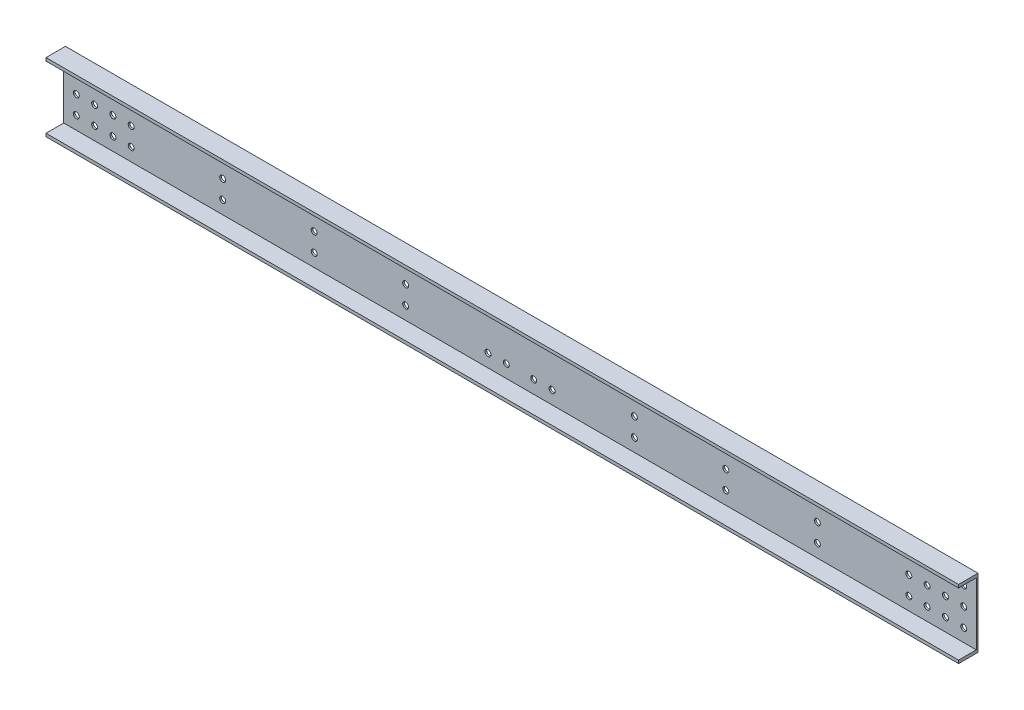
from build123d import *

# Parameters (mm, degrees)
SKETCH_1_W                       = 3990
SKETCH_1_H                       = 300
SKETCH_1_R                       = 13
EXTRUDE_704_DEPTH                = 7.5
SKETCH_2_W                       = 3990
SKETCH_2_H                       = 13.5
EXTRUDE_1_DEPTH                  = 77.5
SKETCH_3_R                       = 13
CUT_EXTRUDE_1_DEPTH              = 2003.436016456
PATTERN_LINEAR_1_COUNT           = 3
PATTERN_LINEAR_1_PITCH           = 400
PATTERN_LINEAR_2_COUNT           = 2
PATTERN_LINEAR_2_PITCH           = 1800
PATTERN_LINEAR_2_COPY_1_SKETCH_R = 13
PATTERN_LINEAR_2_COPY_1_DEPTH    = 2003.436016456
PATTERN_LINEAR_2_COPY_2_SKETCH_R = 13
PATTERN_LINEAR_2_COPY_2_DEPTH    = 2003.436016456


with BuildPart() as part:
    # 草图1 → Extrude 704 (new body)
    with BuildSketch(Plane.XY):
        Rectangle(SKETCH_1_W, SKETCH_1_H)
        with Locations((1940, 0)):
            Circle(SKETCH_1_R, mode=Mode.SUBTRACT)
        with Locations((1860, 0)):
            Circle(SKETCH_1_R, mode=Mode.SUBTRACT)
        with Locations((1780, 0)):
            Circle(SKETCH_1_R, mode=Mode.SUBTRACT)
        with Locations((1700, 0)):
            Circle(SKETCH_1_R, mode=Mode.SUBTRACT)
        with Locations((1700, 80)):
            Circle(SKETCH_1_R, mode=Mode.SUBTRACT)
        with Locations((1780, 80)):
            Circle(SKETCH_1_R, mode=Mode.SUBTRACT)
        with Locations((1860, 80)):
            Circle(SKETCH_1_R, mode=Mode.SUBTRACT)
        with Locations((1940, 80)):
            Circle(SKETCH_1_R, mode=Mode.SUBTRACT)
        with Locations(Location((1940, -80, 0), (0, 0, 180))):
            Circle(SKETCH_1_R, mode=Mode.SUBTRACT)
        with Locations(Location((1860, -80, 0), (0, 0, 180))):
            Circle(SKETCH_1_R, mode=Mode.SUBTRACT)
        with Locations(Location((1780, -80, 0), (0, 0, 180))):
            Circle(SKETCH_1_R, mode=Mode.SUBTRACT)
        with Locations(Location((1700, -80, 0), (0, 0, 180))):
            Circle(SKETCH_1_R, mode=Mode.SUBTRACT)
        with Locations((-1700, -80)):
            Circle(SKETCH_1_R, mode=Mode.SUBTRACT)
        with Locations((-1780, -80)):
            Circle(SKETCH_1_R, mode=Mode.SUBTRACT)
        with Locations((-1860, -80)):
            Circle(SKETCH_1_R, mode=Mode.SUBTRACT)
        with Locations((-1940, -80)):
            Circle(SKETCH_1_R, mode=Mode.SUBTRACT)
        with Locations(Location((-1940, 80, 0), (0, 0, 180))):
            Circle(SKETCH_1_R, mode=Mode.SUBTRACT)
        with Locations(Location((-1860, 80, 0), (0, 0, 180))):
            Circle(SKETCH_1_R, mode=Mode.SUBTRACT)
        with Locations(Location((-1780, 80, 0), (0, 0, 180))):
            Circle(SKETCH_1_R, mode=Mode.SUBTRACT)
        with Locations(Location((-1700, 80, 0), (0, 0, 180))):
            Circle(SKETCH_1_R, mode=Mode.SUBTRACT)
        with Locations(Location((-1700, 0, 0), (0, 0, 180))):
            Circle(SKETCH_1_R, mode=Mode.SUBTRACT)
        with Locations(Location((-1780, 0, 0), (0, 0, 180))):
            Circle(SKETCH_1_R, mode=Mode.SUBTRACT)
        with Locations(Location((-1860, 0, 0), (0, 0, 180))):
            Circle(SKETCH_1_R, mode=Mode.SUBTRACT)
        with Locations(Location((-1940, 0, 0), (0, 0, 180))):
            Circle(SKETCH_1_R, mode=Mode.SUBTRACT)
        with Locations((60, 80)):
            Circle(SKETCH_1_R, mode=Mode.SUBTRACT)
        with Locations((140, 80)):
            Circle(SKETCH_1_R, mode=Mode.SUBTRACT)
        with Locations(Location((140, -80, 0), (0, 0, 180))):
            Circle(SKETCH_1_R, mode=Mode.SUBTRACT)
        with Locations(Location((60, -80, 0), (0, 0, 180))):
            Circle(SKETCH_1_R, mode=Mode.SUBTRACT)
        with Locations((-60, -80)):
            Circle(SKETCH_1_R, mode=Mode.SUBTRACT)
        with Locations((-140, -80)):
            Circle(SKETCH_1_R, mode=Mode.SUBTRACT)
        with Locations(Location((-140, 80, 0), (0, 0, 180))):
            Circle(SKETCH_1_R, mode=Mode.SUBTRACT)
        with Locations(Location((-60, 80, 0), (0, 0, 180))):
            Circle(SKETCH_1_R, mode=Mode.SUBTRACT)
    extrude(amount=EXTRUDE_704_DEPTH)

    # 草图2 → 凸台-拉伸1 (add)
    with BuildSketch(Plane.XY.offset(7.5)):
        with Locations((0, 143.25)):
            Rectangle(SKETCH_2_W, SKETCH_2_H)
        with Locations((0, -143.25)):
            Rectangle(SKETCH_2_W, SKETCH_2_H)
    extrude(amount=EXTRUDE_1_DEPTH)

    # 草图3 → 切除-拉伸1 (cut, through all)
    with BuildSketch(Plane(origin=(0, 0, 0), x_dir=(-1, 0, 0), z_dir=(0, 0, -1))):
        with Locations((-1300, 80)):
            Circle(SKETCH_3_R)
        with Locations((-1300, 0)):
            Circle(SKETCH_3_R)
        with Locations((-1300, -80)):
            Circle(SKETCH_3_R)
    cut_extrude_1 = extrude(amount=-CUT_EXTRUDE_1_DEPTH, mode=Mode.SUBTRACT)

    # 阵列(线性)1: 切除-拉伸1 ×3
    with Locations(*[(-i * PATTERN_LINEAR_1_PITCH, 0, 0) for i in range(1, PATTERN_LINEAR_1_COUNT)]):
        add(cut_extrude_1, mode=Mode.SUBTRACT)

    # 阵列(线性)2: 切除-拉伸1 ×2
    with Locations(*[(-i * PATTERN_LINEAR_2_PITCH, 0, 0) for i in range(1, PATTERN_LINEAR_2_COUNT)]):
        add(cut_extrude_1, mode=Mode.SUBTRACT)

    # 阵列(线性)2 copy 1 sketch → 阵列(线性)2 copy 1 (cut, through all)
    with BuildSketch(Plane(origin=(-2200, 0, 0), x_dir=(-1, 0, 0), z_dir=(0, 0, -1))):
        with Locations((-1300, 80)):
            Circle(PATTERN_LINEAR_2_COPY_1_SKETCH_R)
        with Locations((-1300, 0)):
            Circle(PATTERN_LINEAR_2_COPY_1_SKETCH_R)
        with Locations((-1300, -80)):
            Circle(PATTERN_LINEAR_2_COPY_1_SKETCH_R)
    extrude(amount=-PATTERN_LINEAR_2_COPY_1_DEPTH, mode=Mode.SUBTRACT)

    # 阵列(线性)2 copy 2 sketch → 阵列(线性)2 copy 2 (cut, through all)
    with BuildSketch(Plane(origin=(-2600, 0, 0), x_dir=(-1, 0, 0), z_dir=(0, 0, -1))):
        with Locations((-1300, 80)):
            Circle(PATTERN_LINEAR_2_COPY_2_SKETCH_R)
        with Locations((-1300, 0)):
            Circle(PATTERN_LINEAR_2_COPY_2_SKETCH_R)
        with Locations((-1300, -80)):
            Circle(PATTERN_LINEAR_2_COPY_2_SKETCH_R)
    extrude(amount=-PATTERN_LINEAR_2_COPY_2_DEPTH, mode=Mode.SUBTRACT)


solid = part.part
